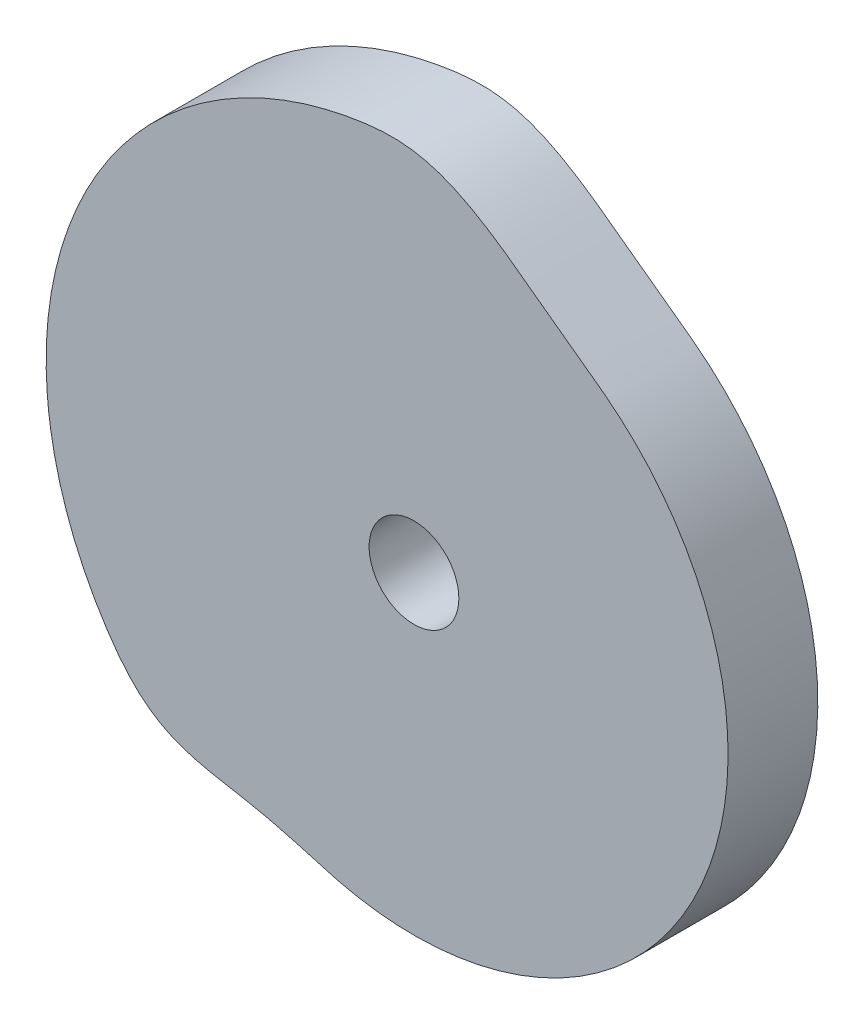
from build123d import *

# Parameters (mm, degrees)
SKETCH_2_R      = 10
EXTRUDE_2_DEPTH = 20


with BuildPart() as part:
    # 草图2 → 凸台-拉伸2 (new body)
    with BuildSketch(Plane.XY):
        with BuildLine():
            add(Edge.make_bspline(
                [(-80.9847, -12.767), (-80.947539482, -13.002595088), (-80.871224563, -13.473442528), (-80.750634993, -14.17867773), (-80.62384213, -14.882807508), (-80.490780849, -15.585777131), (-80.351844828, -16.287630401), (-80.20662378, -16.988181033), (-80.055297195, -17.687469523), (-79.897929145, -18.385404661), (-79.734427686, -19.081932844), (-79.564781247, -19.776974529), (-79.389204573, -20.470541094), (-79.207620797, -21.162582554), (-79.019902818, -21.852963884), (-78.826179771, -22.541718657), (-78.62652168, -23.228759239), (-78.420801253, -23.914015487), (-78.209060328, -24.597420483), (-77.991522824, -25.279013018), (-77.767883803, -25.958618535), (-77.538355846, -26.636270483), (-77.303016893, -27.311920908), (-77.061647357, -27.985446093), (-76.814601123, -28.656873775), (-76.561544377, -29.326068866), (-76.302802297, -29.993100484), (-76.038028849, -30.657774026), (-75.767681775, -31.320204814), (-75.491456545, -31.980176791), (-75.209549885, -32.637751081), (-74.921862841, -33.292805654), (-74.628430758, -33.945354365), (-74.32935261, -34.595312197), (-74.024634949, -35.242633636), (-73.714340839, -35.887282913), (-73.398339047, -36.529163339), (-73.0767052, -37.168259484), (-72.749642912, -37.804593234), (-72.416911244, -38.437990434), (-72.078702054, -39.068464202), (-71.735135691, -39.696050785), (-71.385882944, -40.32046329), (-71.031414869, -40.941950358), (-70.671405799, -41.560224916), (-70.305979328, -42.175320635), (-69.935286152, -42.787276799), (-69.559194342, -43.395906068), (-69.177873543, -44.001279318), (-68.791264216, -44.603250678), (-68.399605308, -45.201710467), (-68.00352153, -45.795287149), (-67.604818, -46.382001601), (-67.20433955, -46.959176219), (-66.80261473, -47.525302917), (-66.399679168, -48.080012052), (-65.99528056, -48.622968571), (-65.589123726, -49.153945533), (-65.180873863, -49.672540862), (-64.770597629, -50.178886889), (-64.357814227, -50.672506943), (-63.942618498, -51.153635043), (-63.524613353, -51.621917314), (-63.103759088, -52.077520794), (-62.679857298, -52.52035718), (-62.252654536, -52.950436553), (-61.822106429, -53.367877497), (-61.388023398, -53.772798266), (-60.950062629, -54.165132407), (-60.508276209, -54.545326571), (-60.062326882, -54.9133447), (-59.612197058, -55.269585349), (-59.157453274, -55.613876541), (-58.698025145, -55.946649138), (-58.233795367, -56.26816643), (-57.764501039, -56.578623241), (-57.289935921, -56.878122194), (-56.809874821, -57.166930443), (-56.324280278, -57.445414335), (-55.832815818, -57.71360182), (-55.335461405, -57.971823546), (-54.832077598, -58.220448471), (-54.322353595, -58.459339501), (-53.80631582, -58.689054261), (-53.283828653, -58.909797265), (-52.754747738, -59.121689791), (-52.219003325, -59.325064621), (-51.676564406, -59.520226457), (-51.127381014, -59.707527008), (-50.571383616, -59.887158134), (-50.008500029, -60.059535671), (-49.43873299, -60.224919297), (-48.862082894, -60.383915526), (-48.278463319, -60.536613066), (-47.687888013, -60.683607572), (-47.090405703, -60.825441333), (-46.486017215, -60.962448653), (-45.874725501, -61.095135398), (-45.256584529, -61.224134009), (-44.631621514, -61.34996016), (-43.999868284, -61.473002188), (-43.361451394, -61.594140508), (-42.716470281, -61.713659404), (-42.065098363, -61.832526352), (-41.407488964, -61.950943145), (-40.743867941, -62.069840466), (-40.074536, -62.189795568), (-39.39971319, -62.31096852), (-38.719861487, -62.434575952), (-38.035257024, -62.560504276), (-37.34638017, -62.689630355), (-36.653726516, -62.822216538), (-35.95784697, -62.958724918), (-35.259294319, -63.099509552), (-34.558584686, -63.244430824), (-33.856403739, -63.39422882), (-33.153320696, -63.548682482), (-32.449846962, -63.707701794), (-31.746703378, -63.871456954), (-31.044434124, -64.039741229), (-30.343638236, -64.212315105), (-29.644781582, -64.388906554), (-28.948369297, -64.569200295), (-28.254828157, -64.752802404), (-27.564626928, -64.939287818), (-26.878134195, -65.128280905), (-26.195588025, -65.318939217), (-25.517400444, -65.511098688), (-24.843760185, -65.703948277), (-24.174925995, -65.896980625), (-23.511106928, -66.089627713), (-22.852492018, -66.281220589), (-22.199236221, -66.471006235), (-21.551589176, -66.658755398), (-20.909583807, -66.843324979), (-20.27353612, -67.024687654), (-19.643462476, -67.201667318), (-19.01967339, -67.374174009), (-18.402304793, -67.541452907), (-17.791516822, -67.70291034), (-17.187342134, -67.85817661), (-16.588472002, -68.006881047), (-15.99256657, -68.14966507), (-15.39696871, -68.28652266), (-14.800512078, -68.418408668), (-14.20285683, -68.544826705), (-13.604162904, -68.666304625), (-13.004398811, -68.782373398), (-12.403666652, -68.89315943), (-11.80201283, -68.998774494), (-11.199462465, -69.09918019), (-10.596039771, -69.194288313), (-9.991807583, -69.284061939), (-9.386825043, -69.368679063), (-8.781110256, -69.448019418), (-8.174703162, -69.521847144), (-7.567722105, -69.590586847), (-6.96016525, -69.653988283), (-6.35207419, -69.712074144), (-5.743490337, -69.764919649), (-5.134455897, -69.812239738), (-4.525043311, -69.854524415), (-3.915280762, -69.891268616), (-3.305225652, -69.922790377), (-2.69493528, -69.948973587), (-2.084414235, -69.969916023), (-1.473722087, -69.985364884), (-0.862933355, -69.995623833), (-0.252075929, -70.000338033), (0.358780405, -70.00002456), (0.969636452, -69.994164335), (1.580394659, -69.983116436), (2.191049557, -69.966572989), (2.801539626, -69.94478732), (3.411828806, -69.91767641), (4.02185604, -69.885311385), (4.6315423, -69.847478333), (5.240898745, -69.804380204), (5.849855826, -69.755986359), (6.45837878, -69.702282831), (7.066369299, -69.643287863), (7.673824928, -69.578977665), (8.280715345, -69.509381013), (8.886973494, -69.43449146), (9.49256279, -69.354282176), (10.097409273, -69.268747689), (10.701556417, -69.178133561), (11.304810829, -69.08191102), (11.90727348, -68.980843109), (12.508722864, -68.87411179), (13.109320499, -68.762530405), (13.70883685, -68.645320519), (14.307393278, -68.523215415), (14.904782371, -68.395619279), (15.501105488, -68.263101318), (16.096184225, -68.125178173), (16.690049717, -67.98201128), (17.282674342, -67.833913655), (17.873962354, -67.680408132), (18.463917039, -67.521990095), (19.052467083, -67.358259594), (19.639501623, -67.189347002), (20.22509356, -67.015420386), (20.809153958, -66.836502043), (21.391562338, -66.652211587), (21.972408729, -66.46304751), (22.551555873, -66.268747904), (23.129002603, -66.069417142), (23.704718851, -65.86515354), (24.278594858, -65.655742627), (24.850596392, -65.441315019), (25.42073867, -65.22202788), (25.988935586, -64.997739638), (26.555134201, -64.768407543), (27.11933409, -64.53422759), (27.681453654, -64.295113941), (28.241475554, -64.051106055), (28.799327974, -63.802225077), (29.355015728, -63.548482327), (29.908450397, -63.289934164), (30.459608745, -63.026463284), (31.008470815, -62.758337211), (31.554932837, -62.485274412), (32.098961491, -62.207482468), (32.640654995, -61.925081464), (33.179803988, -61.637893856), (33.71643194, -61.345995599), (34.250441273, -61.049338356), (34.781925465, -60.748182321), (35.310771705, -60.442381162), (35.836821783, -60.131873202), (36.360158392, -59.816835), (36.880788033, -59.497360191), (37.3986098, -59.173249558), (37.913510078, -58.844555195), (38.425648583, -58.51152364), (38.934765783, -58.173972714), (39.440913128, -57.831902934), (39.944081765, -57.485547239), (40.444231417, -57.134797302), (40.941339002, -56.779759794), (41.43519277, -56.420178002), (41.926042685, -56.056562964), (42.413528526, -55.688450717), (42.897978327, -55.316331102), (43.379016178, -54.939780139), (43.856868915, -54.559217941), (44.331252422, -54.174392873), (44.802276948, -53.785446748), (45.269984876, -53.392499258), (45.734164534, -52.995372584), (46.194890752, -52.594267514), (46.652094786, -52.189137569), (47.105819217, -51.780102669), (47.555767984, -51.366906763), (48.002315925, -50.950063676), (48.445128491, -50.529276158), (48.88411038, -50.104488768), (49.319543873, -49.676057601), (49.751106817, -49.243688194), (50.179069139, -48.807748884), (50.603009052, -48.367924318), (51.023169177, -47.924484951), (51.43941344, -47.477430366), (51.851802478, -47.02678267), (52.260138033, -46.572460651), (52.664701913, -46.114711547), (53.065048667, -45.653299876), (53.461361989, -45.18845337), (53.853720247, -44.720266314), (54.241862131, -44.248554918), (54.62598488, -43.773571111), (55.0059313, -43.295244041), (55.381578551, -42.813540079), (55.753134942, -42.328620908), (56.120382195, -41.840444017), (56.483416139, -41.349164596), (56.842030534, -40.854664641), (57.196442299, -40.35712538), (57.546416222, -39.856411715), (57.892041939, -39.352701192), (58.233213186, -38.845987663), (58.570077018, -38.336390475), (58.902317884, -37.823790765), (59.230174639, -37.308366056), (59.553442088, -36.790051834), (59.872289766, -36.268973703), (60.186405135, -35.745043205), (60.496226353, -35.218559997), (60.801139893, -34.689230047), (61.101594983, -34.157353502), (61.397246957, -33.622815352), (61.688405562, -33.085806046), (61.974801955, -32.546227825), (62.256375661, -32.004103788), (62.533282452, -31.459582066), (62.805510645, -30.912736198), (63.072794398, -30.363436525), (63.335408753, -29.811916204), (63.593091632, -29.258066867), (63.846021604, -28.702022329), (64.094132891, -28.143797375), (64.337187549, -27.583323532), (64.575529901, -27.020878187), (64.808832981, -26.456306562), (65.037203002, -25.88973659), (65.26072123, -25.32123243), (65.479282565, -24.750809261), (65.692599661, -24.178395019), (65.901114664, -23.604222497), (66.104686771, -23.028267742), (66.303008628, -22.450504514), (66.496431023, -21.871055377), (66.68490001, -21.289973937), (66.867996601, -20.707162718), (67.04627988, -20.122884492), (67.219241983, -19.537038554), (67.38716374, -18.949720917), (67.549945912, -18.360925394), (67.707660881, -17.770747778), (67.860173115, -17.179226305), (68.007436722, -16.586385552), (68.149705532, -15.992326974), (68.286526366, -15.396969596), (68.418407675, -14.80051184), (68.544826971, -14.202856893), (68.666304553, -13.604162887), (68.782373417, -13.004398816), (68.893159425, -12.403666651), (68.998774496, -11.80201283), (69.09918019, -11.199462465), (69.194288313, -10.596039771), (69.284061939, -9.991807583), (69.368679063, -9.386825043), (69.448019418, -8.781110256), (69.521847144, -8.174703162), (69.590586847, -7.567722105), (69.653988283, -6.96016525), (69.712074144, -6.35207419), (69.764919649, -5.743490337), (69.812239738, -5.134455897), (69.854524415, -4.525043311), (69.891268616, -3.915280762), (69.922790377, -3.305225652), (69.948973587, -2.69493528), (69.969916023, -2.084414235), (69.985364884, -1.473722087), (69.995623833, -0.862933355), (70.000338033, -0.252075929), (70.00002456, 0.358780405), (69.994164335, 0.969636452), (69.983116436, 1.580394659), (69.966572989, 2.191049557), (69.94478732, 2.801539626), (69.91767641, 3.411828806), (69.885311385, 4.02185604), (69.847478333, 4.6315423), (69.804380204, 5.240898745), (69.755986359, 5.849855826), (69.702282831, 6.45837878), (69.643287863, 7.066369299), (69.578977665, 7.673824928), (69.509381013, 8.280715345), (69.43449146, 8.886973494), (69.354282176, 9.49256279), (69.268747689, 10.097409273), (69.178133561, 10.701556417), (69.08191102, 11.304810829), (68.980843109, 11.90727348), (68.87411179, 12.508722864), (68.762530405, 13.109320499), (68.645320519, 13.70883685), (68.523215415, 14.307393278), (68.395619279, 14.904782371), (68.263101318, 15.501105488), (68.125178173, 16.096184225), (67.98201128, 16.690049717), (67.833913655, 17.282674342), (67.680408132, 17.873962354), (67.521990095, 18.463917039), (67.358259594, 19.052467083), (67.189347002, 19.639501623), (67.015420386, 20.22509356), (66.836502043, 20.809153958), (66.652211587, 21.391562338), (66.46304751, 21.972408729), (66.268747904, 22.551555873), (66.069417142, 23.129002603), (65.86515354, 23.704718851), (65.655742627, 24.278594858), (65.441315019, 24.850596392), (65.22202788, 25.42073867), (64.997739638, 25.988935586), (64.768407543, 26.555134201), (64.53422759, 27.11933409), (64.295113941, 27.681453654), (64.051106055, 28.241475554), (63.802225077, 28.799327974), (63.548482327, 29.355015728), (63.289934164, 29.908450397), (63.026463284, 30.459608745), (62.758337211, 31.008470815), (62.485274412, 31.554932837), (62.207482468, 32.098961491), (61.925081464, 32.640654995), (61.637893856, 33.179803988), (61.345995599, 33.71643194), (61.049338356, 34.250441273), (60.748182321, 34.781925465), (60.442381162, 35.310771705), (60.131873202, 35.836821783), (59.816835, 36.360158392), (59.497360191, 36.880788033), (59.173249558, 37.3986098), (58.844555195, 37.913510078), (58.51152364, 38.425648583), (58.173972714, 38.934765783), (57.831902934, 39.440913128), (57.485547239, 39.944081765), (57.134797302, 40.444231417), (56.779759794, 40.941339002), (56.420178002, 41.43519277), (56.056562964, 41.926042685), (55.688450717, 42.413528526), (55.316331102, 42.897978327), (54.939780139, 43.379016178), (54.559217941, 43.856868915), (54.174392873, 44.331252422), (53.785446748, 44.802276948), (53.392499258, 45.269984876), (52.995372584, 45.734164534), (52.594267514, 46.194890752), (52.189137569, 46.652094786), (51.780102669, 47.105819217), (51.366906763, 47.555767984), (50.950063676, 48.002315925), (50.529276158, 48.445128491), (50.104488768, 48.88411038), (49.676057601, 49.319543873), (49.243688194, 49.751106817), (48.807748884, 50.179069139), (48.367924319, 50.603009053), (47.924484951, 51.023169177), (47.477430367, 51.43941344), (47.026782667, 51.851802475), (46.572460661, 52.260138046), (46.114711509, 52.664701866), (45.653300017, 53.065048844), (45.188452847, 53.46136133), (44.720268268, 53.853722708), (44.248346607, 54.242018342), (43.771865253, 54.627419554), (43.288429518, 55.011233064), (42.796314647, 55.395770875), (42.294453491, 55.78228413), (41.782866706, 56.171333082), (41.261767202, 56.563258138), (40.731487419, 56.958539357), (40.191999701, 57.357068912), (39.644009137, 57.759615951), (39.087737047, 58.166207701), (38.52350145, 58.577068727), (37.951666726, 58.992271196), (37.372786607, 59.412286084), (36.787028922, 59.836801991), (36.195033164, 60.266274538), (35.596918538, 60.700337721), (34.993386022, 61.139385197), (34.384489425, 61.582986648), (33.770818078, 62.031314585), (33.152573103, 62.48412106), (32.530228461, 62.941409468), (31.903793547, 63.402584319), (31.273763149, 63.867767886), (30.640349492, 64.33661845), (30.003584522, 64.80859808), (29.364067187, 65.283844358), (28.721605917, 65.761418293), (28.076545051, 66.241204267), (27.429157399, 66.722911723), (26.779281113, 67.2056657), (26.127409935, 67.689418244), (25.473483426, 68.173318981), (24.817712076, 68.65702913), (24.160191295, 69.139840648), (23.501151851, 69.621319903), (22.840748507, 70.100773143), (22.179060022, 70.577571275), (21.5163158, 71.051089168), (20.852634484, 71.520659209), (20.188362894, 71.985744123), (19.523500982, 72.445521181), (18.858351752, 72.899407619), (18.192954081, 73.346513599), (17.52790628, 73.786687499), (16.863036875, 74.218720129), (16.19878941, 74.642365309), (15.535311071, 75.056843007), (14.872803555, 75.461528282), (14.21172575, 75.85611184), (13.551986452, 76.239604052), (12.894020235, 76.611868254), (12.237956466, 76.97229506), (11.583989331, 77.320499582), (10.932272488, 77.656023758), (10.283061965, 77.978709136), (9.636428769, 78.288136986), (8.992460658, 78.584008474), (8.351216295, 78.866205936), (7.712796377, 79.134649429), (7.077096156, 79.389011582), (6.444216206, 79.629556616), (5.813977685, 79.856092473), (5.186268102, 80.06856449), (4.560947146, 80.267214839), (3.937773626, 80.452020102), (3.316479976, 80.623092217), (2.696838272, 80.780705928), (2.078493105, 80.924928591), (1.460969208, 81.055731534), (0.844005957, 81.173772326), (0.22705152, 81.278665764), (-0.390211982, 81.370992347), (-1.008292964, 81.450982058), (-1.627704159, 81.518413234), (-2.248854991, 81.573935305), (-2.872273109, 81.617543278), (-3.498426562, 81.649259152), (-4.127767206, 81.669553979), (-4.760737972, 81.678352465), (-5.397732124, 81.676095199), (-6.039184539, 81.662898983), (-6.685466884, 81.639059593), (-7.336962861, 81.60449503), (-7.994025753, 81.559836061), (-8.656932407, 81.505068628), (-9.325985428, 81.440835796), (-10.001399593, 81.366940294), (-10.683458137, 81.284166807), (-11.372361907, 81.192617957), (-12.068031014, 81.09285553), (-12.769288286, 80.985396144), (-13.47367309, 80.871174021), (-14.178678193, 80.750637894), (-14.882807383, 80.623841353), (-15.585777164, 80.490781058), (-16.287630392, 80.351844772), (-16.988181035, 80.206623795), (-17.687469523, 80.055297191), (-18.385404661, 79.897929146), (-19.081932844, 79.734427685), (-19.776974529, 79.564781247), (-20.470541094, 79.389204573), (-21.162582554, 79.207620797), (-21.852963884, 79.019902818), (-22.541718657, 78.826179771), (-23.228759239, 78.62652168), (-23.914015487, 78.420801253), (-24.597420483, 78.209060328), (-25.279013018, 77.991522824), (-25.958618535, 77.767883803), (-26.636270483, 77.538355846), (-27.311920908, 77.303016893), (-27.985446093, 77.061647357), (-28.656873775, 76.814601123), (-29.326068866, 76.561544377), (-29.993100484, 76.302802297), (-30.657774026, 76.038028849), (-31.320204814, 75.767681775), (-31.980176791, 75.491456545), (-32.637751081, 75.209549885), (-33.292805654, 74.921862841), (-33.945354365, 74.628430758), (-34.595312197, 74.32935261), (-35.242633636, 74.024634949), (-35.887282913, 73.714340839), (-36.529163339, 73.398339047), (-37.168259484, 73.0767052), (-37.804593234, 72.749642912), (-38.437990434, 72.416911244), (-39.068464202, 72.078702054), (-39.696050785, 71.735135691), (-40.32046329, 71.385882944), (-40.941950358, 71.031414869), (-41.560224916, 70.671405798), (-42.175320636, 70.305979329), (-42.787276796, 69.935286147), (-43.395906079, 69.559194358), (-44.001279277, 69.177873483), (-44.603250835, 68.79126444), (-45.201911014, 68.399472844), (-45.797049665, 68.00234871), (-46.388801699, 67.60019219), (-46.976893085, 67.192716955), (-47.561506757, 66.78028355), (-48.142395789, 66.3626088), (-48.719751429, 65.940051068), (-49.293282798, 65.512324853), (-49.863186032, 65.079748289), (-50.42909614, 64.6419876), (-50.991349843, 64.199563687), (-51.549571304, 63.752063104), (-52.10396223, 63.299824266), (-52.654332048, 62.842679449), (-53.20082972, 62.380924656), (-53.743042241, 61.914142378), (-54.281398063, 61.442908831), (-54.815505716, 60.966875059), (-55.345405385, 60.486167188), (-55.871087885, 60.000842384), (-56.392642862, 59.511063405), (-56.909783751, 59.016663388), (-57.422678811, 58.517821025), (-57.931093792, 58.014463402), (-58.435153302, 57.506718038), (-58.934764506, 56.994591272), (-59.429924273, 56.478177178), (-59.920500349, 55.957350275), (-60.406533479, 55.432344126), (-60.887974929, 54.90308152), (-61.364797838, 54.369694987), (-61.836885242, 53.832080453), (-62.304273914, 53.290368683), (-62.766991747, 52.744676868), (-63.224909261, 52.194983183), (-63.677931617, 51.641238104), (-64.126076103, 51.083526437), (-64.569552275, 50.52207104), (-65.007902372, 49.95660517), (-65.441467337, 49.387470481), (-65.869774479, 48.814384341), (-66.293406515, 48.237830001), (-66.711681833, 47.657382541), (-67.125208968, 47.073519941), (-67.533327641, 46.485872902), (-67.936475476, 45.894795839), (-68.334347646, 45.300177589), (-68.727099312, 44.702145757), (-69.114561021, 44.100676631), (-69.496785349, 43.495859699), (-69.873659465, 42.887745417), (-70.245326254, 42.276440807), (-70.611489984, 41.661800545), (-70.97239238, 41.044024013), (-71.327925298, 40.423129904), (-71.677886433, 39.799091588), (-72.022529477, 39.172102769), (-72.361600067, 38.542089321), (-72.695239934, 37.909196951), (-73.023229361, 37.273343302), (-73.34571451, 36.634689209), (-73.662642834, 35.993239617), (-73.973956778, 35.349064877), (-74.279514936, 34.702132761), (-74.57956583, 34.052641794), (-74.873830182, 33.4004812), (-75.162580386, 32.745883887), (-75.445329523, 32.088655771), (-75.722579438, 31.429109291), (-75.993954845, 30.767102557), (-76.259562254, 30.102776573), (-76.519402283, 29.436175301), (-76.77324559, 28.767278413), (-77.021371898, 28.096226847), (-77.263718895, 27.423071301), (-77.49993958, 26.747724777), (-77.730517274, 26.070445488), (-77.954990256, 25.391096091), (-78.173568135, 24.709827786), (-78.386297453, 24.026719049), (-78.593020985, 23.341763857), (-78.793678857, 22.655023078), (-78.988399354, 21.966567672), (-79.177136812, 21.276458227), (-79.359687102, 20.584674458), (-79.536287989, 19.891347599), (-79.706956602, 19.19655213), (-79.871290021, 18.500225463), (-80.029686742, 17.802531469), (-80.182151738, 17.103498892), (-80.328336191, 16.403133147), (-80.468280501, 15.701481551), (-80.602347194, 14.99871295), (-80.730116933, 14.294740005), (-80.851821974, 13.589719345), (-80.967353658, 12.883629585), (-81.076591157, 12.17658754), (-81.179853556, 11.468607672), (-81.276828227, 10.759742972), (-81.367630009, 10.050049158), (-81.452231767, 9.339621976), (-81.530639054, 8.62849531), (-81.602822261, 7.916699876), (-81.668874364, 7.204279819), (-81.728486961, 6.491306506), (-81.782164817, 5.777857335), (-81.829460867, 5.063961832), (-81.870393965, 4.349660797), (-81.905360832, 3.635040679), (-81.933964079, 2.920145627), (-81.956180448, 2.205047991), (-81.972510482, 1.48979228), (-81.982180876, 0.774394926), (-81.985967137, 0.058936038), (-81.983350387, -0.656525473), (-81.974430472, -1.371918675), (-81.959327655, -2.087211977), (-81.93806123, -2.802341428), (-81.910425761, -3.517266275), (-81.876630149, -4.231926452), (-81.836660688, -4.94629105), (-81.79031878, -5.660246811), (-81.737874051, -6.373781072), (-81.678987474, -7.086795495), (-81.614170332, -7.799302738), (-81.542928321, -8.511223407), (-81.465508834, -9.222477472), (-81.382060582, -9.933052195), (-81.292233311, -10.642839533), (-81.196201832, -11.351824119), (-81.094172212, -12.059971803), (-81.021857341, -12.531425055), (-80.9847, -12.767)],
                knots=[0, 0, 0, 0, 0.001502077, 0.00300398, 0.004505859, 0.006007831, 0.007509724, 0.009011732, 0.01051352, 0.01201561, 0.013517503, 0.015019314, 0.016521313, 0.018023203, 0.019525153, 0.021027021, 0.022529122, 0.024030967, 0.025532872, 0.027034888, 0.028536793, 0.030038639, 0.031540736, 0.033042605, 0.034544486, 0.036046369, 0.037548294, 0.039050257, 0.040552217, 0.042054171, 0.043555961, 0.045057975, 0.046559861, 0.048061925, 0.049563811, 0.051065631, 0.052567593, 0.054069532, 0.055571465, 0.057073418, 0.058575406, 0.060077259, 0.061579293, 0.063081133, 0.0645831, 0.066085024, 0.06758691, 0.069088983, 0.070590778, 0.072092699, 0.073594569, 0.075095106, 0.076586737, 0.078061972, 0.079519289, 0.080958467, 0.082379727, 0.083782866, 0.085168477, 0.086536207, 0.087887015, 0.089220769, 0.090538365, 0.091840022, 0.093126718, 0.094398867, 0.095657506, 0.096903243, 0.098137165, 0.099360341, 0.100573731, 0.101778278, 0.102975299, 0.104165587, 0.105350678, 0.1065314, 0.107709048, 0.108884561, 0.110059438, 0.1112342, 0.112410311, 0.113588458, 0.114769782, 0.115955298, 0.117145619, 0.118341723, 0.119544444, 0.120754387, 0.121972117, 0.123198565, 0.124434027, 0.125679429, 0.126934848, 0.12820108, 0.129478588, 0.13076759, 0.132068423, 0.133381439, 0.134707004, 0.136045202, 0.137396301, 0.138760419, 0.140137572, 0.141527429, 0.142930393, 0.144345696, 0.145773354, 0.147212895, 0.148663587, 0.150125136, 0.151596749, 0.153077568, 0.15456654, 0.156062792, 0.157565375, 0.159072863, 0.160584491, 0.162098834, 0.163614975, 0.165131245, 0.166646789, 0.168160293, 0.169670839, 0.17117725, 0.172678541, 0.174173462, 0.175661501, 0.177141647, 0.178612706, 0.180074398, 0.181525773, 0.18296582, 0.184394186, 0.185809975, 0.187212522, 0.188601197, 0.189975352, 0.191334175, 0.192677159, 0.194003612, 0.195312917, 0.196605751, 0.197889688, 0.199172007, 0.20045443, 0.201736758, 0.203019174, 0.204301692, 0.205584001, 0.206866235, 0.208148698, 0.209431038, 0.210713355, 0.211995775, 0.213278159, 0.21456058, 0.215842977, 0.217125215, 0.218407599, 0.219690019, 0.220972346, 0.22225471, 0.223537178, 0.224819444, 0.226101814, 0.227384174, 0.228666616, 0.229949034, 0.231231312, 0.232513762, 0.233796059, 0.235078509, 0.236360797, 0.237643223, 0.238925675, 0.240208039, 0.241490427, 0.242772713, 0.244055205, 0.24533758, 0.246619936, 0.247902163, 0.249184565, 0.250467033, 0.251749248, 0.253031723, 0.254314111, 0.255596573, 0.256878899, 0.258161291, 0.259443531, 0.260726038, 0.262008377, 0.263290731, 0.264573107, 0.26585549, 0.267137728, 0.268420276, 0.269702468, 0.270984957, 0.272267288, 0.273549762, 0.274831958, 0.276114433, 0.277396745, 0.278679068, 0.279961562, 0.281243861, 0.282526258, 0.283808726, 0.285091093, 0.286373384, 0.287655769, 0.288938153, 0.290220555, 0.291502877, 0.292785218, 0.294067676, 0.295349878, 0.296632391, 0.297914654, 0.299197144, 0.300479392, 0.301761874, 0.303044119, 0.304326605, 0.305608962, 0.306891289, 0.308173763, 0.309456117, 0.310738553, 0.312020777, 0.313303064, 0.314585442, 0.315868012, 0.317150176, 0.318432727, 0.319715008, 0.320997465, 0.322279728, 0.323562186, 0.324844599, 0.326126985, 0.32740923, 0.328691641, 0.329974108, 0.331256472, 0.332538796, 0.333821048, 0.335103486, 0.336385886, 0.337668209, 0.338950553, 0.340233016, 0.341515384, 0.342797779, 0.344080135, 0.345362399, 0.346644825, 0.34792721, 0.349209652, 0.350492103, 0.351774361, 0.353056819, 0.354338981, 0.355621396, 0.356903849, 0.358186317, 0.359468584, 0.360750881, 0.362033333, 0.363315711, 0.364597982, 0.365880408, 0.367162756, 0.36844529, 0.369727646, 0.371009797, 0.372292257, 0.373574709, 0.374857079, 0.376139466, 0.37742179, 0.378704211, 0.379986473, 0.381268851, 0.382551266, 0.383833704, 0.385116012, 0.386398434, 0.387680813, 0.388963141, 0.390245435, 0.391527874, 0.392810275, 0.394092647, 0.395375085, 0.396657313, 0.3979398, 0.399222086, 0.400504356, 0.401786897, 0.403069255, 0.404351694, 0.405633955, 0.406916409, 0.408198765, 0.409481041, 0.41076346, 0.412045873, 0.413328106, 0.414610584, 0.415892877, 0.417175279, 0.418457761, 0.419740147, 0.42102241, 0.422304709, 0.423587142, 0.424869602, 0.42615193, 0.427434225, 0.428716634, 0.429998954, 0.431281377, 0.432563704, 0.43384612, 0.435128639, 0.436410948, 0.437693182, 0.438975645, 0.440257985, 0.441540302, 0.442822722, 0.444105106, 0.445387527, 0.446669924, 0.447952162, 0.449234546, 0.450516966, 0.451799293, 0.453081657, 0.454364125, 0.455646391, 0.456928761, 0.458211121, 0.459493563, 0.460775981, 0.462058259, 0.463340709, 0.464623006, 0.465905456, 0.467187743, 0.46847017, 0.469752622, 0.471034986, 0.472317374, 0.47359966, 0.474882151, 0.476164527, 0.477446883, 0.47872911, 0.480011512, 0.48129398, 0.482576194, 0.48385867, 0.485141058, 0.48642352, 0.487705845, 0.488988238, 0.490270478, 0.491552985, 0.492835324, 0.494117677, 0.495400054, 0.496682437, 0.497964675, 0.499247223, 0.500529415, 0.501811904, 0.503094235, 0.504376709, 0.505658905, 0.50694138, 0.508223692, 0.509506015, 0.510788509, 0.512070808, 0.513353205, 0.514635673, 0.51591804, 0.517200331, 0.518482716, 0.5197651, 0.521047502, 0.522329824, 0.523612165, 0.524894623, 0.526176825, 0.527459338, 0.528741601, 0.530024091, 0.531306339, 0.532588821, 0.533871066, 0.535153552, 0.536435909, 0.537718236, 0.53900071, 0.540283063, 0.5415655, 0.542847724, 0.544130011, 0.545412389, 0.546694958, 0.547977122, 0.549259674, 0.550541955, 0.551824412, 0.553106675, 0.554389133, 0.555671546, 0.556953932, 0.558236177, 0.559518587, 0.560801055, 0.562083419, 0.563365743, 0.564647995, 0.565930433, 0.567212833, 0.568495156, 0.5697775, 0.571059962, 0.57234233, 0.573624726, 0.574907082, 0.576189346, 0.577471772, 0.578754157, 0.580036599, 0.58131905, 0.582601308, 0.583883766, 0.585165928, 0.586448343, 0.587730796, 0.589013264, 0.590295531, 0.591577828, 0.592860279, 0.594144297, 0.595437321, 0.596747699, 0.598077493, 0.599426647, 0.600795378, 0.602183888, 0.603591992, 0.605019487, 0.606466124, 0.607931354, 0.609415214, 0.610916639, 0.612435582, 0.613971147, 0.615522701, 0.617089813, 0.618671433, 0.620267178, 0.621876126, 0.623497646, 0.625130906, 0.626775107, 0.628429834, 0.630093958, 0.631766848, 0.633447755, 0.635135504, 0.636829845, 0.638529732, 0.640233991, 0.641942168, 0.643653009, 0.645365899, 0.647079592, 0.648793191, 0.650505509, 0.652215958, 0.653922911, 0.655625629, 0.657322855, 0.659013761, 0.660696955, 0.662371532, 0.664036374, 0.665690499, 0.667333187, 0.668963098, 0.670579608, 0.672181686, 0.673768869, 0.675340507, 0.676895801, 0.678434736, 0.679956765, 0.681461463, 0.682949189, 0.684419759, 0.685873484, 0.687310617, 0.688731672, 0.690137221, 0.691528134, 0.692904967, 0.694269083, 0.695621458, 0.69696313, 0.698295489, 0.69961994, 0.700938217, 0.702251231, 0.703560898, 0.704868633, 0.706175999, 0.707484637, 0.708795896, 0.710111529, 0.711432872, 0.712761217, 0.714098045, 0.715444383, 0.716801646, 0.718170812, 0.719553003, 0.720949117, 0.722359777, 0.723785838, 0.725228033, 0.72668669, 0.728162495, 0.729653989, 0.731154582, 0.732656486, 0.734158365, 0.735660336, 0.737162229, 0.738664238, 0.740166025, 0.741668115, 0.743170008, 0.74467182, 0.746173818, 0.747675708, 0.749177658, 0.750679526, 0.752181628, 0.753683472, 0.755185377, 0.756687393, 0.758189299, 0.759691144, 0.761193241, 0.76269511, 0.764196991, 0.765698874, 0.767200799, 0.768702762, 0.770204722, 0.771706677, 0.773208466, 0.774710481, 0.776212367, 0.77771443, 0.779216316, 0.780718137, 0.782220099, 0.783722037, 0.785223971, 0.786725923, 0.788227911, 0.789729764, 0.791231799, 0.792733638, 0.794235605, 0.795737529, 0.797239415, 0.798741488, 0.800243283, 0.801745204, 0.803247075, 0.804749125, 0.806251061, 0.807752942, 0.809254936, 0.810756814, 0.812258739, 0.813760778, 0.815262628, 0.816764657, 0.818266595, 0.819768355, 0.82127038, 0.822772326, 0.824274172, 0.825776144, 0.827278104, 0.828779989, 0.830281914, 0.831783855, 0.83328578, 0.834787794, 0.836289571, 0.837791668, 0.83929346, 0.840795356, 0.84229747, 0.843799178, 0.845301334, 0.846803159, 0.848305066, 0.849807029, 0.851309006, 0.852810951, 0.854312841, 0.855814658, 0.857316651, 0.858818604, 0.860320537, 0.861822528, 0.863324437, 0.864826294, 0.866328302, 0.867830186, 0.869332162, 0.87083412, 0.872336056, 0.873837909, 0.875339969, 0.876841885, 0.87834377, 0.87984556, 0.88134744, 0.882849452, 0.884351422, 0.885853362, 0.887355304, 0.888857262, 0.890359165, 0.891861031, 0.893363069, 0.894864926, 0.896366902, 0.897868834, 0.899370736, 0.900872632, 0.902374724, 0.903876487, 0.905378479, 0.906880457, 0.90838234, 0.909884243, 0.911386207, 0.912888027, 0.914390012, 0.915891939, 0.917393863, 0.918895762, 0.920397819, 0.921899744, 0.923401591, 0.924903675, 0.926405507, 0.927907402, 0.92940942, 0.930911325, 0.932413228, 0.933915145, 0.935417084, 0.936918951, 0.938420977, 0.939922867, 0.941424817, 0.942926657, 0.944428744, 0.945930537, 0.947432566, 0.948934353, 0.950436399, 0.951938401, 0.953440265, 0.954942108, 0.956444041, 0.957945971, 0.959447994, 0.96094984, 0.962451801, 0.963953783, 0.965455715, 0.96695769, 0.968459613, 0.969961402, 0.971463367, 0.97296542, 0.974467254, 0.975969194, 0.977471142, 0.978973001, 0.980474893, 0.981976924, 0.983478788, 0.984980821, 0.986482705, 0.987984571, 0.989486499, 0.990988431, 0.992490462, 0.993992264, 0.99549421, 0.99699618, 0.998498051, 1, 1, 1, 1], degree=3))
        make_face()
        Circle(SKETCH_2_R, mode=Mode.SUBTRACT)
    extrude(amount=EXTRUDE_2_DEPTH)


solid = part.part
